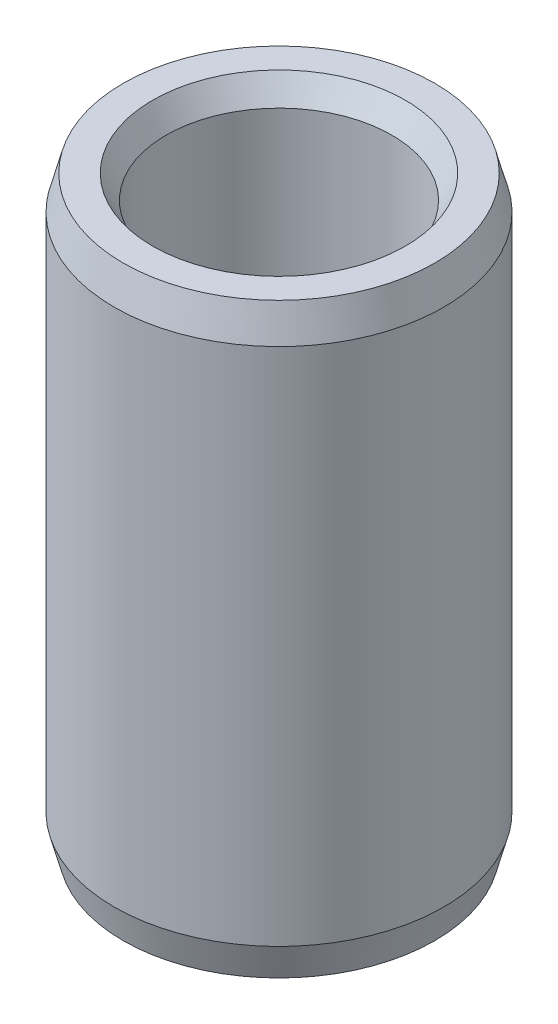
from build123d import *
from OCP.BRepFilletAPI import BRepFilletAPI_MakeChamfer

# Parameters (mm, degrees)
SKETCH1_R           = 36.5
SKETCH1_R_2         = 25
BOSS_EXTRUDE1_DEPTH = 130
CHAMFER1_SIZE       = 3
CHAMFER1_SIZE2      = 5.196152423
CHAMFER2_SIZE       = 2
CHAMFER2_SIZE2      = 7.464101615
CHAMFER3_SIZE       = 2
CHAMFER3_SIZE2      = 7.464101615


with BuildPart() as part:
    # Sketch1 → Boss-Extrude1 (new body)
    with BuildSketch(Plane(origin=(0, 0, 0), x_dir=(1, 0, 0), z_dir=(0, 1, 0))):
        with Locations(Location((0, 0, 0), (0, 0, 270))):
            Circle(SKETCH1_R)
        with Locations(Location((0, 0, 0), (0, 0, 270))):
            Circle(SKETCH1_R_2, mode=Mode.SUBTRACT)
    extrude(amount=-BOSS_EXTRUDE1_DEPTH)

    # Chamfer1: one chamfer whose edges measure the first distance from different faces: ONE call of the kernel's chamfer builder (chamfer() names one face for all edges)
    chamfer1_edges_1 = [part.edges().sort_by_distance(p)[0] for p in [
        (0, -130, -25),
    ]]
    chamfer1_side_1 = [part.faces().sort_by_distance(p)[0] for p in [
        (0, -65, -25),
    ]]
    chamfer1_edges_2 = [part.edges().sort_by_distance(p)[0] for p in [
        (0, 0, -25),
    ]]
    chamfer1_side_2 = [part.faces().sort_by_distance(p)[0] for p in [
        (0, 0, -35.467624099),
    ]]
    chamfer1 = BRepFilletAPI_MakeChamfer(part.part.solid().wrapped)
    for e in chamfer1_edges_1:
        chamfer1.Add(CHAMFER1_SIZE, CHAMFER1_SIZE2, e.wrapped, chamfer1_side_1[0].wrapped)  # the first distance lies on this face
    for e in chamfer1_edges_2:
        chamfer1.Add(CHAMFER1_SIZE, CHAMFER1_SIZE2, e.wrapped, chamfer1_side_2[0].wrapped)  # the first distance lies on this face
    add(Compound.cast(chamfer1.Shape()), mode=Mode.REPLACE)

    # Chamfer2
    chamfer2_edges = [part.edges().sort_by_distance(p)[0] for p in [
        (0, -130, -36.5),
    ]]
    chamfer2_side = [part.faces().sort_by_distance(p)[0] for p in [
        (0, -130, -31.228528323),
    ]]
    chamfer(chamfer2_edges, length=CHAMFER2_SIZE, length2=CHAMFER2_SIZE2, reference=chamfer2_side[0])

    # Chamfer3
    chamfer3_edges = [part.edges().sort_by_distance(p)[0] for p in [
        (0, 0, -36.5),
    ]]
    chamfer3_side = [part.faces().sort_by_distance(p)[0] for p in [
        (0, 0, -29.032375901),
    ]]
    chamfer(chamfer3_edges, length=CHAMFER3_SIZE, length2=CHAMFER3_SIZE2, reference=chamfer3_side[0])


solid = part.part
